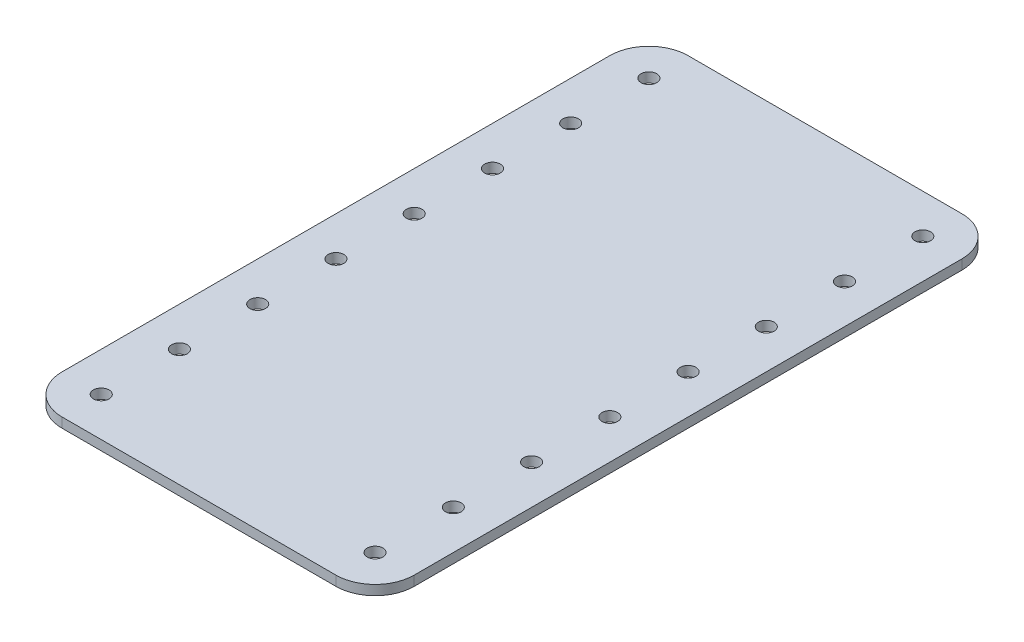
from build123d import *

# Parameters (mm, degrees)
SKETCH1_W           = 114.3
SKETCH1_H           = 203.2
BOSS_EXTRUDE1_DEPTH = 3.175
SKETCH2_R           = 2.54
CUT_EXTRUDE1_DEPTH  = 3.175
FILLET1_R           = 12.7


with BuildPart() as part:
    # Sketch1 → Boss-Extrude1 (new body)
    with BuildSketch(Plane(origin=(0, 0, 0), x_dir=(1, 0, 0), z_dir=(0, 1, 0))):
        Rectangle(SKETCH1_W, SKETCH1_H)
    extrude(amount=BOSS_EXTRUDE1_DEPTH)

    # Sketch2 → Cut-Extrude1 (cut)
    with BuildSketch(Plane(origin=(0, 3.175, 0), x_dir=(1, 0, 0), z_dir=(0, 1, 0))):
        with Locations(Location((-44.45, 88.9, 0), (0, 0, 270))):
            Circle(SKETCH2_R)
        with Locations(Location((-44.45, 63.5, 0), (0, 0, 270))):
            Circle(SKETCH2_R)
        with Locations(Location((-44.45, 38.1, 0), (0, 0, 270))):
            Circle(SKETCH2_R)
        with Locations(Location((-44.45, 12.7, 0), (0, 0, 270))):
            Circle(SKETCH2_R)
        with Locations(Location((-44.45, -12.7, 0), (0, 0, 270))):
            Circle(SKETCH2_R)
        with Locations(Location((-44.45, -38.1, 0), (0, 0, 270))):
            Circle(SKETCH2_R)
        with Locations(Location((-44.45, -63.5, 0), (0, 0, 270))):
            Circle(SKETCH2_R)
        with Locations(Location((-44.45, -88.9, 0), (0, 0, 270))):
            Circle(SKETCH2_R)
        with Locations(Location((44.45, -88.9, 0), (0, 0, 90))):
            Circle(SKETCH2_R)
        with Locations(Location((44.45, -63.5, 0), (0, 0, 90))):
            Circle(SKETCH2_R)
        with Locations(Location((44.45, -38.1, 0), (0, 0, 90))):
            Circle(SKETCH2_R)
        with Locations(Location((44.45, -12.7, 0), (0, 0, 90))):
            Circle(SKETCH2_R)
        with Locations(Location((44.45, 12.7, 0), (0, 0, 90))):
            Circle(SKETCH2_R)
        with Locations(Location((44.45, 38.1, 0), (0, 0, 90))):
            Circle(SKETCH2_R)
        with Locations(Location((44.45, 63.5, 0), (0, 0, 90))):
            Circle(SKETCH2_R)
        with Locations(Location((44.45, 88.9, 0), (0, 0, 90))):
            Circle(SKETCH2_R)
    extrude(amount=-CUT_EXTRUDE1_DEPTH, mode=Mode.SUBTRACT)

    # Fillet1
    fillet1_edges = [part.edges().sort_by_distance(p)[0] for p in [
        (57.15, 1.5875, 101.6),
        (-57.15, 1.5875, 101.6),
        (-57.15, 1.5875, -101.6),
        (57.15, 1.5875, -101.6),
    ]]
    fillet(fillet1_edges, radius=FILLET1_R)


solid = part.part
